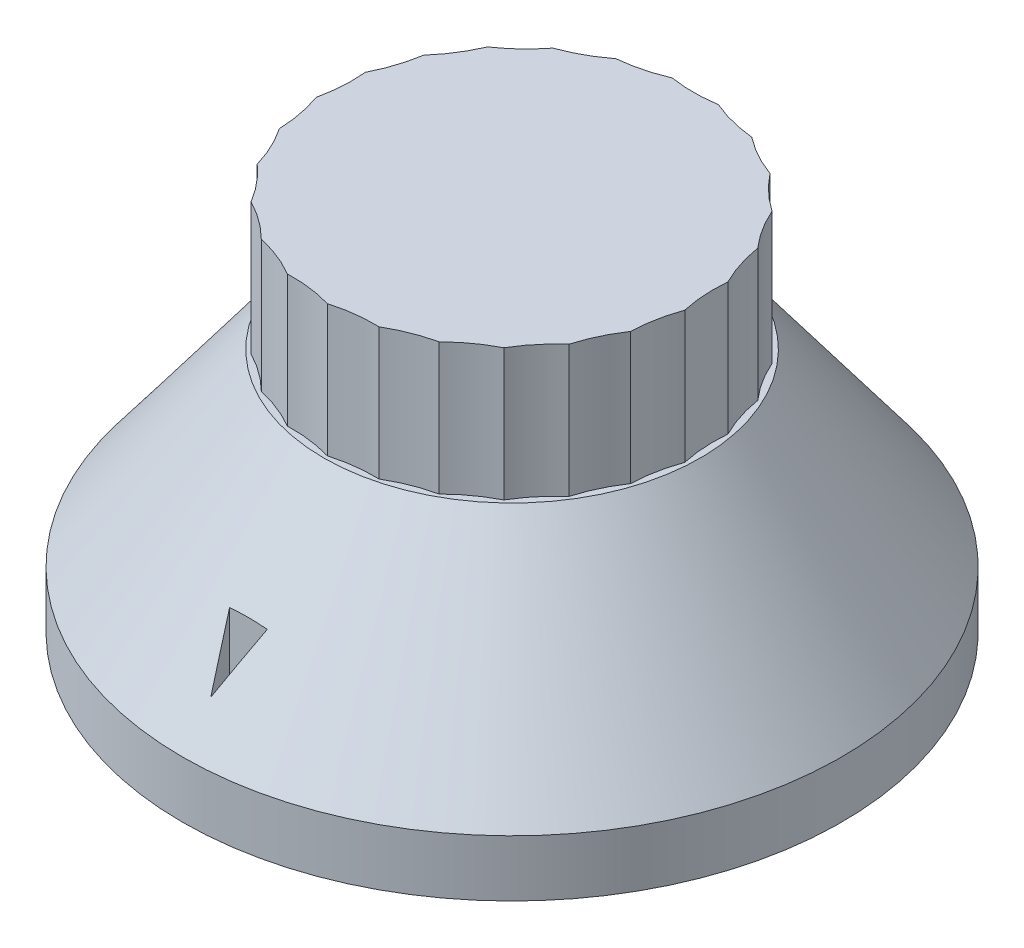
from build123d import *

# Parameters (mm, degrees)
SKETCH1_R                = 12.7
BOSS_EXTRUDE1_DEPTH      = 8.89
SKETCH2_R                = 22.225
BOSS_EXTRUDE3_DEPTH      = 3.81
SKETCH4_R                = 7.62
CUT_EXTRUDE2_DEPTH       = 3.81
BOSS_EXTRUDE4_DEPTH      = 3.81
BOSS_EXTRUDE4_DEPTH_BACK = 6.35
SKETCH7_R                = 3.175
CUT_EXTRUDE3_DEPTH       = 12.7
CUT_EXTRUDE4_DEPTH       = 12.7
CUT_EXTRUDE_THIN2_DEPTH  = 8.89


with BuildPart() as part:
    # Sketch1 → Boss-Extrude1 (new body)
    with BuildSketch(Plane(origin=(0, 0, 0), x_dir=(1, 0, 0), z_dir=(0, 1, 0))):
        with Locations(Location((0, 0, 0), (0, 0, 270))):
            Circle(SKETCH1_R)
    extrude(amount=BOSS_EXTRUDE1_DEPTH)



with BuildPart() as body_2:
    # Sketch2 → Boss-Extrude3 (new body)
    with BuildSketch(Plane(origin=(0, -16.51, 0), x_dir=(1, 0, 0), z_dir=(0, 1, 0))):
        with Locations(Location((0, 0, 0), (0, 0, 90))):
            Circle(SKETCH2_R)
    extrude(amount=BOSS_EXTRUDE3_DEPTH)


with BuildPart() as part_1:
    add(part.part)

    add(body_2.part)  # loft2 joins it to this body
    # loft up to a face of the part (loft2)
    loft([Face(Wire([part_1.edges().sort_by_distance((-9.257901568, 0, -8.693748245))[0]])), Face(Wire([part_1.edges().sort_by_distance((-16.201327744, -12.7, 15.214059429))[0]]))])

    # Sketch4 → Cut-Extrude2 (cut)
    with BuildSketch(Plane(origin=(0, -16.51, 0), x_dir=(1, 0, 0), z_dir=(0, 1, 0))):
        with Locations(Location((0, 0, 0), (0, 0, 90))):
            Circle(SKETCH4_R)
    extrude(amount=CUT_EXTRUDE2_DEPTH, mode=Mode.SUBTRACT)

    # Sketch3 → Boss-Extrude4 (add, two sides: drawn at the far end of the back side and taken through both)
    with BuildSketch(Plane(origin=(0, -16.51, 0), x_dir=(1, 0, 0), z_dir=(0, 1, 0)).offset(-BOSS_EXTRUDE4_DEPTH_BACK)):
        with BuildLine():
            Line((0, 3.175), (4.779691024, 5.934555899))
            ThreePointArc((4.779691024, 5.934555899), (0, 7.62), (-4.779691024, 5.934555899))
            Line((-4.779691024, 5.934555899), (0, 3.175))
        make_face()
        with BuildLine():
            Line((2.749630657, -1.5875), (2.749630657, -7.106611798))
            ThreePointArc((2.749630657, -7.106611798), (6.599113577, -3.81), (7.529321681, 1.172055899))
            Line((7.529321681, 1.172055899), (2.749630657, -1.5875))
        make_face()
        with BuildLine():
            Line((-2.749630657, -1.5875), (-7.529321681, 1.172055899))
            ThreePointArc((-7.529321681, 1.172055899), (-6.599113577, -3.81), (-2.749630657, -7.106611798))
            Line((-2.749630657, -7.106611798), (-2.749630657, -1.5875))
        make_face()
    extrude(amount=BOSS_EXTRUDE4_DEPTH + BOSS_EXTRUDE4_DEPTH_BACK)

    # Sketch7 → Cut-Extrude3 (cut)
    with BuildSketch(Plane.XZ.offset(12.7)):
        with Locations(Location((0, 0, 0), (0, 0, 270))):
            Circle(SKETCH7_R)
    extrude(amount=-CUT_EXTRUDE3_DEPTH, mode=Mode.SUBTRACT)

    # Sketch9 → Cut-Extrude4 (cut)
    with BuildSketch(Plane(origin=(0, 0, 0), x_dir=(1, 0, 0), z_dir=(0, 1, 0))):
        Polygon((0, -20.32), (1.27, -17.78), (-1.27, -17.78), align=None)
    extrude(amount=-CUT_EXTRUDE4_DEPTH, mode=Mode.SUBTRACT)

    # Sketch10 → Cut-Extrude-Thin2 (cut)
    with BuildSketch(Plane(origin=(0, 8.89, 0), x_dir=(1, 0, 0), z_dir=(0, 1, 0))):
        with BuildLine():
            ThreePointArc((2.277411846, 12.494134435), (0, 12.231184444), (-2.277411846, 12.494134435))
            Line((-2.277411846, 12.494134435), (-1.698591269, 14.967303806))
            ThreePointArc((-1.698591269, 14.967303806), (0, 14.771184444), (1.698591269, 14.967303806))
            Line((1.698591269, 14.967303806), (2.277411846, 12.494134435))
        make_face()
        with BuildLine():
            ThreePointArc((5.313027648, 11.535238932), (3.041771879, 11.846919293), (0.901302118, 12.667977522))
            Line((0.901302118, 12.667977522), (2.076990194, 14.919500905))
            ThreePointArc((2.076990194, 14.919500905), (3.673444193, 14.307120523), (5.367443996, 14.074655963))
            Line((5.367443996, 14.074655963), (5.313027648, 11.535238932))
        make_face()
        with BuildLine():
            ThreePointArc((8.014806383, 9.851541942), (5.892418045, 10.718268633), (4.023383955, 12.045844991))
            Line((4.023383955, 12.045844991), (5.722066724, 13.934250892))
            ThreePointArc((5.722066724, 13.934250892), (7.116072377, 12.944087601), (8.699040476, 12.297645723))
            Line((8.699040476, 12.297645723), (8.014806383, 9.851541942))
        make_face()
        with BuildLine():
            ThreePointArc((10.212985356, 7.548836342), (8.372821913, 8.916149736), (6.892661781, 10.666827718))
            Line((6.892661781, 10.666827718), (9.007604758, 12.073460649))
            ThreePointArc((9.007604758, 12.073460649), (10.111571563, 10.76773005), (11.48404425, 9.747929175))
            Line((11.48404425, 9.747929175), (10.212985356, 7.548836342))
        make_face()
        with BuildLine():
            ThreePointArc((11.769444899, 4.771809591), (10.327130588, 6.55379636), (9.328848318, 8.61757443))
            Line((9.328848318, 8.61757443), (11.727161858, 9.454050471))
            ThreePointArc((11.727161858, 9.454050471), (12.471723519, 7.914796419), (13.547463289, 6.585714386))
            Line((13.547463289, 6.585714386), (11.769444899, 4.771809591))
        make_face()
        with BuildLine():
            ThreePointArc((12.586386934, 1.694952494), (11.632547668, 3.779643855), (11.178869006, 6.026847247))
            Line((11.178869006, 6.026847247), (13.709858248, 6.240607531))
            ThreePointArc((13.709858248, 6.240607531), (14.048231219, 4.56454702), (14.759645385, 3.009694941))
            Line((14.759645385, 3.009694941), (12.586386934, 1.694952494))
        make_face()
        with BuildLine():
            ThreePointArc((12.612479988, -1.488404702), (12.207048996, 0.768002426), (12.326480242, 3.057431087))
            Line((12.326480242, 3.057431087), (14.831113823, 2.635044269))
            ThreePointArc((14.831113823, 2.635044269), (14.742036886, 0.927490345), (15.04442468, -0.755434705))
            Line((15.04442468, -0.755434705), (12.612479988, -1.488404702))
        make_face()
        with BuildLine():
            ThreePointArc((11.846084539, -4.578239956), (12.014536541, -2.29189542), (12.69957339, -0.104094714))
            Line((12.69957339, -0.104094714), (15.020475972, -1.136088515))
            ThreePointArc((15.020475972, -1.136088515), (14.509546158, -2.767843959), (14.383907442, -4.473097611))
            Line((14.383907442, -4.473097611), (11.846084539, -4.578239956))
        make_face()
        with BuildLine():
            ThreePointArc((10.335356031, -7.380407557), (11.067106569, -5.207785048), (12.274705637, -3.25907986))
            Line((12.274705637, -3.25907986), (14.266046374, -4.83583668))
            ThreePointArc((14.266046374, -4.83583668), (13.365367282, -6.289264448), (12.819596399, -7.909699343))
            Line((12.819596399, -7.909699343), (10.335356031, -7.380407557))
        make_face()
        with BuildLine():
            ThreePointArc((8.175219094, -9.718837007), (9.424289589, -7.796450388), (11.078572985, -6.209285033))
            Line((11.078572985, -6.209285033), (12.615228615, -8.231731441))
            ThreePointArc((12.615228615, -8.231731441), (11.381393226, -9.415507322), (10.449782968, -10.849305575))
            Line((10.449782968, -10.849305575), (8.175219094, -9.718837007))
        make_face()
        with BuildLine():
            ThreePointArc((5.501403074, -11.446596185), (7.189309834, -9.895236077), (9.186332848, -8.769337991))
            Line((9.186332848, -8.769337991), (10.171749647, -11.110396242))
            ThreePointArc((10.171749647, -11.110396242), (8.682284375, -11.950139243), (7.423371241, -13.107210037))
            Line((7.423371241, -13.107210037), (5.501403074, -11.446596185))
        make_face()
        with BuildLine():
            ThreePointArc((2.481913667, -12.455123626), (4.502599302, -11.372267691), (6.716881634, -10.778381192))
            Line((6.716881634, -10.778381192), (7.08914224, -13.290953985))
            ThreePointArc((7.08914224, -13.290953985), (5.437635666, -13.733899965), (3.930521798, -14.541540287))
            Line((3.930521798, -14.541540287), (2.481913667, -12.455123626))
        make_face()
        with BuildLine():
            ThreePointArc((-0.693523504, -12.681049844), (1.532973897, -12.134737902), (3.825384043, -12.110179062))
            Line((3.825384043, -12.110179062), (3.561097953, -14.636392209))
            ThreePointArc((3.561097953, -14.636392209), (1.85132031, -14.654709243), (0.190703214, -15.062172082))
            Line((0.190703214, -15.062172082), (-0.693523504, -12.681049844))
        make_face()
        with BuildLine():
            ThreePointArc((-3.825384043, -12.110179062), (-1.532973897, -12.134737902), (0.693523504, -12.681049844))
            Line((0.693523504, -12.681049844), (-0.190703214, -15.062172082))
            ThreePointArc((-0.190703214, -15.062172082), (-1.85132031, -14.654709243), (-3.561097953, -14.636392209))
            Line((-3.561097953, -14.636392209), (-3.825384043, -12.110179062))
        make_face()
        with BuildLine():
            ThreePointArc((-6.716881634, -10.778381192), (-4.502599302, -11.372267691), (-2.481913667, -12.455123626))
            Line((-2.481913667, -12.455123626), (-3.930521798, -14.541540287))
            ThreePointArc((-3.930521798, -14.541540287), (-5.437635666, -13.733899965), (-7.08914224, -13.290953985))
            Line((-7.08914224, -13.290953985), (-6.716881634, -10.778381192))
        make_face()
        with BuildLine():
            ThreePointArc((-9.186332848, -8.769337991), (-7.189309834, -9.895236077), (-5.501403074, -11.446596185))
            Line((-5.501403074, -11.446596185), (-7.423371241, -13.107210037))
            ThreePointArc((-7.423371241, -13.107210037), (-8.682284375, -11.950139243), (-10.171749647, -11.110396242))
            Line((-10.171749647, -11.110396242), (-9.186332848, -8.769337991))
        make_face()
        with BuildLine():
            ThreePointArc((-11.078572985, -6.209285033), (-9.424289589, -7.796450388), (-8.175219094, -9.718837007))
            Line((-8.175219094, -9.718837007), (-10.449782968, -10.849305575))
            ThreePointArc((-10.449782968, -10.849305575), (-11.381393226, -9.415507322), (-12.615228615, -8.231731441))
            Line((-12.615228615, -8.231731441), (-11.078572985, -6.209285033))
        make_face()
        with BuildLine():
            ThreePointArc((-12.274705637, -3.25907986), (-11.067106569, -5.207785048), (-10.335356031, -7.380407557))
            Line((-10.335356031, -7.380407557), (-12.819596399, -7.909699343))
            ThreePointArc((-12.819596399, -7.909699343), (-13.365367282, -6.289264448), (-14.266046374, -4.83583668))
            Line((-14.266046374, -4.83583668), (-12.274705637, -3.25907986))
        make_face()
        with BuildLine():
            ThreePointArc((-12.69957339, -0.104094714), (-12.014536541, -2.29189542), (-11.846084539, -4.578239956))
            Line((-11.846084539, -4.578239956), (-14.383907442, -4.473097611))
            ThreePointArc((-14.383907442, -4.473097611), (-14.509546158, -2.767843959), (-15.020475972, -1.136088515))
            Line((-15.020475972, -1.136088515), (-12.69957339, -0.104094714))
        make_face()
        with BuildLine():
            ThreePointArc((-12.326480242, 3.057431087), (-12.207048996, 0.768002426), (-12.612479988, -1.488404702))
            Line((-12.612479988, -1.488404702), (-15.04442468, -0.755434705))
            ThreePointArc((-15.04442468, -0.755434705), (-14.742036886, 0.927490345), (-14.831113823, 2.635044269))
            Line((-14.831113823, 2.635044269), (-12.326480242, 3.057431087))
        make_face()
        with BuildLine():
            ThreePointArc((-11.178869006, 6.026847247), (-11.632547668, 3.779643855), (-12.586386934, 1.694952494))
            Line((-12.586386934, 1.694952494), (-14.759645385, 3.009694941))
            ThreePointArc((-14.759645385, 3.009694941), (-14.048231219, 4.56454702), (-13.709858248, 6.240607531))
            Line((-13.709858248, 6.240607531), (-11.178869006, 6.026847247))
        make_face()
        with BuildLine():
            ThreePointArc((-9.328848318, 8.61757443), (-10.327130588, 6.55379636), (-11.769444899, 4.771809591))
            Line((-11.769444899, 4.771809591), (-13.547463289, 6.585714386))
            ThreePointArc((-13.547463289, 6.585714386), (-12.471723519, 7.914796419), (-11.727161858, 9.454050471))
            Line((-11.727161858, 9.454050471), (-9.328848318, 8.61757443))
        make_face()
        with BuildLine():
            ThreePointArc((-6.892661781, 10.666827718), (-8.372821913, 8.916149736), (-10.212985356, 7.548836342))
            Line((-10.212985356, 7.548836342), (-11.48404425, 9.747929175))
            ThreePointArc((-11.48404425, 9.747929175), (-10.111571563, 10.76773005), (-9.007604758, 12.073460649))
            Line((-9.007604758, 12.073460649), (-6.892661781, 10.666827718))
        make_face()
        with BuildLine():
            ThreePointArc((-4.023383955, 12.045844991), (-5.892418045, 10.718268633), (-8.014806383, 9.851541942))
            Line((-8.014806383, 9.851541942), (-8.699040476, 12.297645723))
            ThreePointArc((-8.699040476, 12.297645723), (-7.116072377, 12.944087601), (-5.722066724, 13.934250892))
            Line((-5.722066724, 13.934250892), (-4.023383955, 12.045844991))
        make_face()
        with BuildLine():
            ThreePointArc((-0.901302118, 12.667977522), (-3.041771879, 11.846919293), (-5.313027648, 11.535238932))
            Line((-5.313027648, 11.535238932), (-5.367443996, 14.074655963))
            ThreePointArc((-5.367443996, 14.074655963), (-3.673444193, 14.307120523), (-2.076990194, 14.919500905))
            Line((-2.076990194, 14.919500905), (-0.901302118, 12.667977522))
        make_face()
    extrude(amount=-CUT_EXTRUDE_THIN2_DEPTH, mode=Mode.SUBTRACT)


solid = part_1.part
